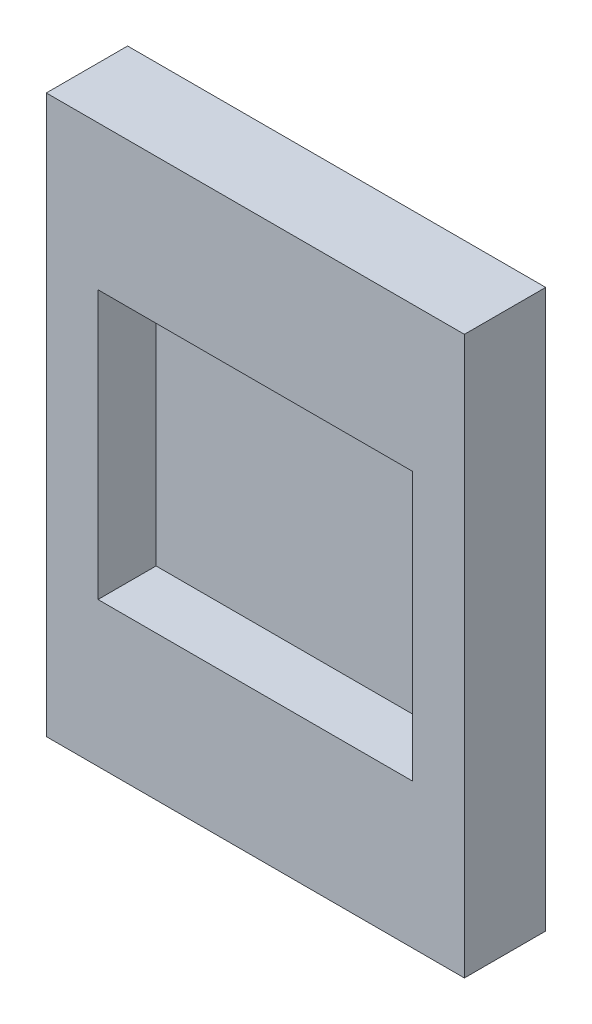
from build123d import *

# Parameters (mm, degrees)
SKETCH_1_W          = 18
SKETCH_1_H          = 24
EXTRUDE_1_DEPTH     = 3.5
SKETCH_2_W          = 13.55
SKETCH_2_H          = 11.55
CUT_EXTRUDE_1_DEPTH = 2.5


with BuildPart() as part:
    # 스케치1 → 보스-돌출1 (new body)
    with BuildSketch(Plane.XY):
        Rectangle(SKETCH_1_W, SKETCH_1_H)
    extrude(amount=EXTRUDE_1_DEPTH)

    # 스케치2 → 컷-돌출1 (cut)
    with BuildSketch(Plane.XY.offset(3.5)):
        Rectangle(SKETCH_2_W, SKETCH_2_H)
    extrude(amount=-CUT_EXTRUDE_1_DEPTH, mode=Mode.SUBTRACT)


solid = part.part
